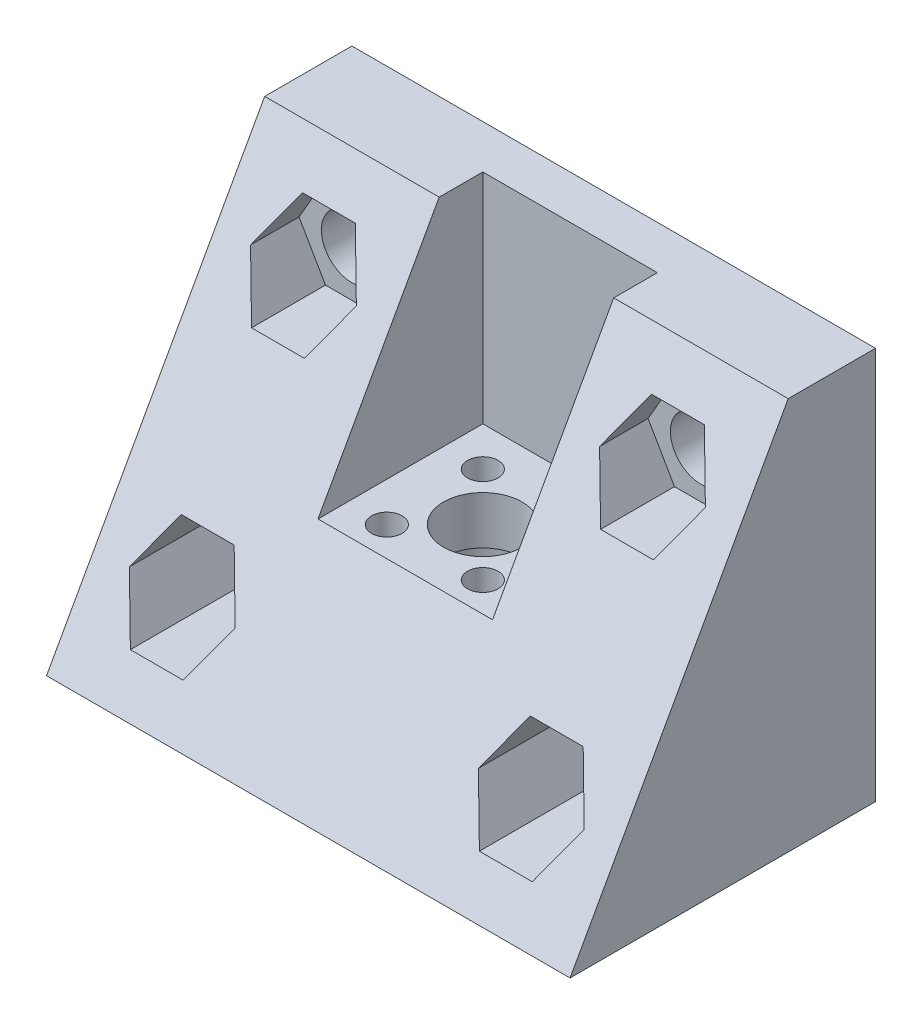
from build123d import *

# Parameters (mm, degrees)
SKETCH1_W           = 60
SKETCH1_H           = 45
BOSS_EXTRUDE1_DEPTH = 35
SKETCH2_R           = 4.5
CUT_EXTRUDE1_DEPTH  = 50
SKETCH3_R           = 11.25
CUT_EXTRUDE2_DEPTH  = 4
SKETCH6_W           = 20
SKETCH6_H           = 25
CUT_EXTRUDE4_DEPTH  = 30
CUT_EXTRUDE3_DEPTH  = 80
SKETCH7_R           = 1.75
CUT_EXTRUDE5_DEPTH  = 25
SKETCH8_R           = 3.5
CUT_EXTRUDE6_DEPTH  = 44
CUT_EXTRUDE7_START  = 35
CUT_EXTRUDE7_DEPTH  = 25
SKETCH10_R          = 5.1
CUT_EXTRUDE8_DEPTH  = 10.5


with BuildPart() as part:
    # Sketch1 → Boss-Extrude1 (new body)
    with BuildSketch(Plane.XY):
        with Locations((30, 22.5)):
            Rectangle(SKETCH1_W, SKETCH1_H)
    extrude(amount=BOSS_EXTRUDE1_DEPTH)

    # Sketch2 → Cut-Extrude1 (cut)
    with BuildSketch(Plane.XZ):
        with Locations(Location((30, 15, 0), (0, 0, 270))):
            Circle(SKETCH2_R)
    extrude(amount=-CUT_EXTRUDE1_DEPTH, mode=Mode.SUBTRACT)

    # Sketch3 → Cut-Extrude2 (cut)
    with BuildSketch(Plane.XZ):
        with Locations(Location((30, 15, 0), (0, 0, 270))):
            Circle(SKETCH3_R)
    extrude(amount=-CUT_EXTRUDE2_DEPTH, mode=Mode.SUBTRACT)

    # Sketch6 → Cut-Extrude4 (cut)
    with BuildSketch(Plane.XY.offset(35)):
        with Locations((30, 32.5)):
            Rectangle(SKETCH6_W, SKETCH6_H)
    extrude(amount=-CUT_EXTRUDE4_DEPTH, mode=Mode.SUBTRACT)

    # Sketch4 → Cut-Extrude3 (cut)
    with BuildSketch(Plane(origin=(60, 0, 0), x_dir=(0, 0, -1), z_dir=(1, 0, 0))):
        Polygon((-35, 0), (-10, 45), (-35, 45), align=None)
    extrude(amount=-CUT_EXTRUDE3_DEPTH, mode=Mode.SUBTRACT)

    # Sketch7 → Cut-Extrude5 (cut)
    with BuildSketch(Plane.XZ.offset(-4)):
        with Locations(Location((24.5, 20.5, 0), (0, 0, 270))):
            Circle(SKETCH7_R)
        with Locations(Location((35.5, 20.5, 0), (0, 0, 270))):
            Circle(SKETCH7_R)
        with Locations(Location((35.5, 9.5, 0), (0, 0, 270))):
            Circle(SKETCH7_R)
        with Locations(Location((24.5, 9.5, 0), (0, 0, 270))):
            Circle(SKETCH7_R)
    extrude(amount=-CUT_EXTRUDE5_DEPTH, mode=Mode.SUBTRACT)

    # Sketch8 → Cut-Extrude6 (cut)
    with BuildSketch(Plane(origin=(0, 0, 0), x_dir=(-1, 0, 0), z_dir=(0, 0, -1))):
        with Locations((-50, 10)):
            Circle(SKETCH8_R)
        with Locations((-50, 35)):
            Circle(SKETCH8_R)
        with Locations((-10, 35)):
            Circle(SKETCH8_R)
        with Locations((-10, 10)):
            Circle(SKETCH8_R)
    extrude(amount=-CUT_EXTRUDE6_DEPTH, mode=Mode.SUBTRACT)

    # Sketch9 → Cut-Extrude7 (cut)
    with BuildSketch(Plane.XY.offset(CUT_EXTRUDE7_START)):
        Polygon((6.968911087, 40.25), (3.937822174, 35), (6.968911087, 29.75), (13.031088913, 29.75), (16.062177826, 35), (13.031088913, 40.25), align=None)
        Polygon((13.031088913, 4.75), (16.062177826, 10), (13.031088913, 15.25), (6.968911087, 15.25), (3.937822174, 10), (6.968911087, 4.75), align=None)
        Polygon((53.031088913, 29.75), (56.062177826, 35), (53.031088913, 40.25), (46.968911087, 40.25), (43.937822174, 35), (46.968911087, 29.75), align=None)
        Polygon((53.031088913, 4.75), (56.062177826, 10), (53.031088913, 15.25), (46.968911087, 15.25), (43.937822174, 10), (46.968911087, 4.75), align=None)
    extrude(amount=-CUT_EXTRUDE7_DEPTH, mode=Mode.SUBTRACT)

    # Sketch10 → Cut-Extrude8 (cut)
    with BuildSketch(Plane.XZ.offset(-4)):
        with Locations(Location((30, 15, 0), (0, 0, 270))):
            Circle(SKETCH10_R)
    extrude(amount=-CUT_EXTRUDE8_DEPTH, mode=Mode.SUBTRACT)


solid = part.part
